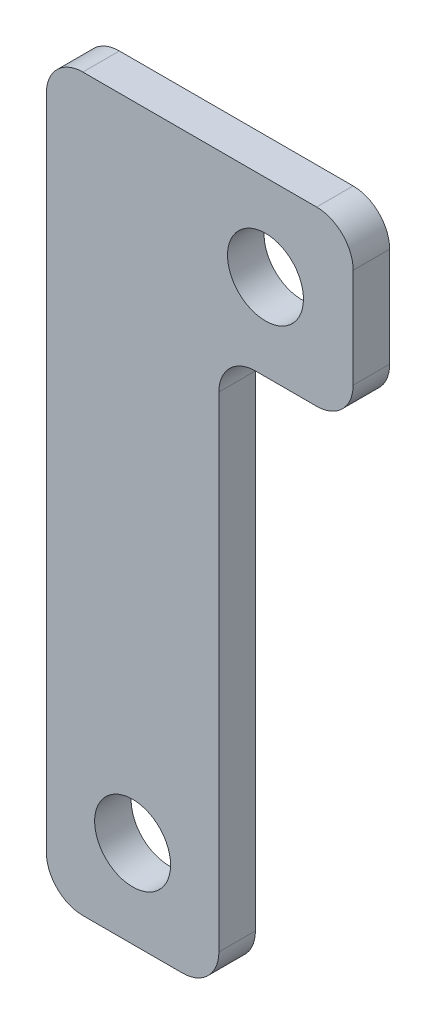
from build123d import *

# Parameters (mm, degrees)
BOSS_EXTRUDE1_DEPTH  = 3.175
M6_CLEARANCE_HOLE1_D = 6.6
FILLET1_R            = 3.175


with BuildPart() as part:
    # Sketch1 → Boss-Extrude1 (new body)
    with BuildSketch(Plane.XY):
        Polygon((-141.015921324, 133.528527902), (-133.395921324, 133.528527902), (-133.395921324, 118.528527902), (-141.015921324, 118.528527902), (-145.065921324, 118.528527902), (-145.065921324, 70.028527902), (-160.065921324, 70.028527902), (-160.065921324, 133.528527902), align=None)
    extrude(amount=BOSS_EXTRUDE1_DEPTH)

    # M6 Clearance Hole1 (through all)
    with Locations(Plane.XY.offset(3.175)):
        with Locations((-141.015921324, 126.028527902), (-152.565921324, 77.648527902)):
            Hole(M6_CLEARANCE_HOLE1_D / 2)

    # Fillet1
    fillet1_edges = [part.edges().sort_by_distance(p)[0] for p in [
        (-145.065921324, 118.528527902, 1.5875),
        (-145.065921324, 70.028527902, 1.5875),
        (-160.065921324, 70.028527902, 1.5875),
        (-160.065921324, 133.528527902, 1.5875),
        (-133.395921324, 133.528527902, 1.5875),
        (-133.395921324, 118.528527902, 1.5875),
    ]]
    fillet(fillet1_edges, radius=FILLET1_R)


solid = part.part
